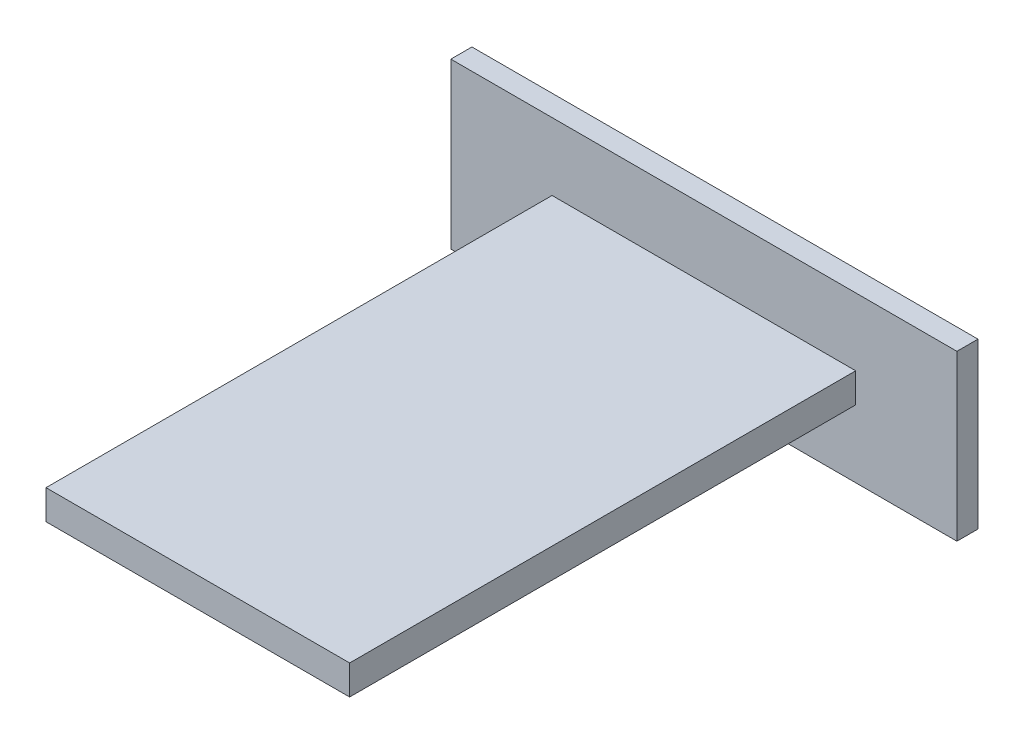
from build123d import *

# Parameters (mm, degrees)
SKETCH1_W           = 18
SKETCH1_H           = 30
BOSS_EXTRUDE1_DEPTH = 1.75
SKETCH2_W           = 30
SKETCH2_H           = 9.75
BOSS_EXTRUDE2_DEPTH = 1.25


with BuildPart() as part:
    # Sketch1 → Boss-Extrude1 (new body)
    with BuildSketch(Plane(origin=(0, 0, 0), x_dir=(1, 0, 0), z_dir=(0, 1, 0))):
        Rectangle(SKETCH1_W, SKETCH1_H)
    extrude(amount=BOSS_EXTRUDE1_DEPTH)

    # Sketch2 → Boss-Extrude2 (add)
    with BuildSketch(Plane(origin=(0, 0, -15), x_dir=(-1, 0, 0), z_dir=(0, 0, -1))):
        with Locations((0, 0.875)):
            Rectangle(SKETCH2_W, SKETCH2_H)
    extrude(amount=BOSS_EXTRUDE2_DEPTH)


solid = part.part
